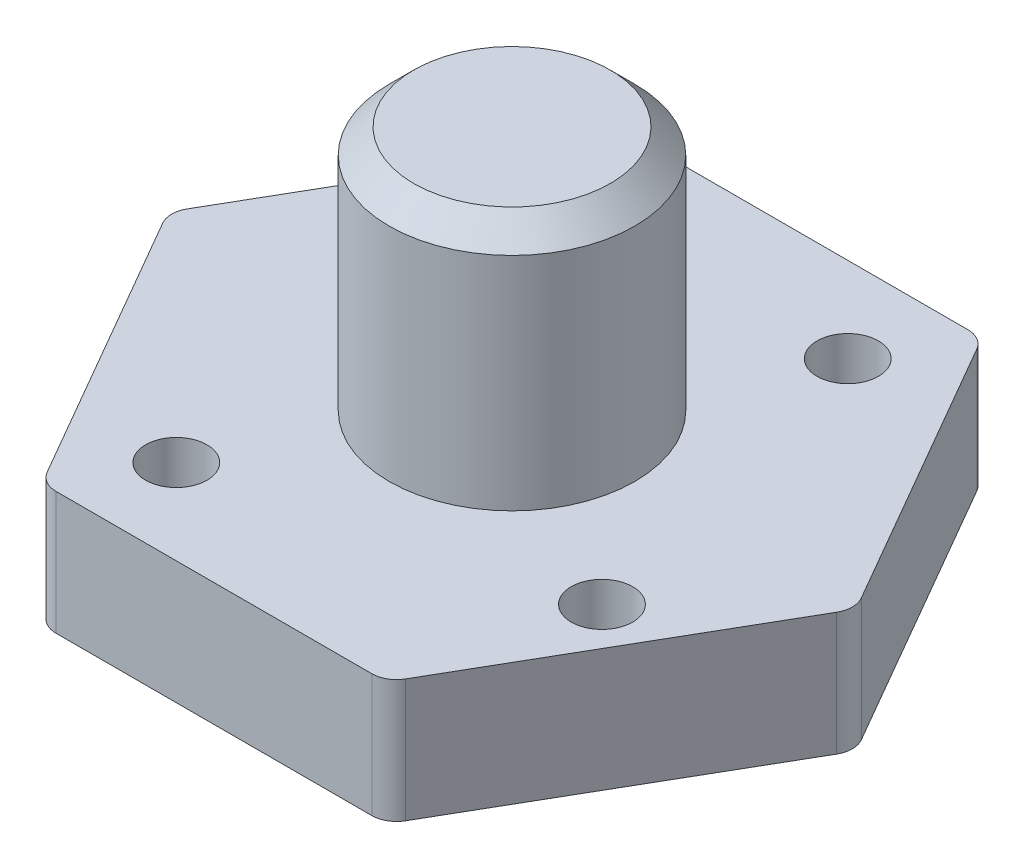
from build123d import *

# Parameters (mm, degrees)
SKETCH_1_R      = 1.25
EXTRUDE_1_DEPTH = 5
SKETCH_2_R      = 5
EXTRUDE_2_DEPTH = 10
FILLET_1_R      = 1
CHAMFER_1_SIZE  = 1


with BuildPart() as part:
    # Эскиз1 → Бобышка-Вытянуть1 (new body)
    with BuildSketch(Plane(origin=(0, 0, 0), x_dir=(1, 0, 0), z_dir=(0, 1, 0))):
        Polygon((14, 0), (7, 12.124355653), (-7, 12.124355653), (-14, 0), (-7, -12.124355653), (7, -12.124355653), align=None)
        with Locations(Location((5, 8.660254038, 0), (0, 0, 270))):
            Circle(SKETCH_1_R, mode=Mode.SUBTRACT)
        with Locations(Location((8.660254038, -5, 0), (0, 0, 270))):
            Circle(SKETCH_1_R, mode=Mode.SUBTRACT)
        with Locations(Location((-5, -8.660254038, 0), (0, 0, 270))):
            Circle(SKETCH_1_R, mode=Mode.SUBTRACT)
        with Locations(Location((-8.660254038, 5, 0), (0, 0, 270))):
            Circle(SKETCH_1_R, mode=Mode.SUBTRACT)
    extrude(amount=EXTRUDE_1_DEPTH)

    # Эскиз2 → Бобышка-Вытянуть2 (add)
    with BuildSketch(Plane(origin=(0, 5, 0), x_dir=(1, 0, 0), z_dir=(0, 1, 0))):
        with Locations(Location((0, 0, 0), (0, 0, 270))):
            Circle(SKETCH_2_R)
    extrude(amount=EXTRUDE_2_DEPTH)

    # Скругление1
    fillet_1_edges = [part.edges().sort_by_distance(p)[0] for p in [
        (7, 2.5, 12.124355653),
        (-7, 2.5, 12.124355653),
        (-14, 2.5, 0),
        (-7, 2.5, -12.124355653),
        (7, 2.5, -12.124355653),
        (14, 2.5, 0),
    ]]
    fillet(fillet_1_edges, radius=FILLET_1_R)

    # Фаска1
    chamfer_1_edges = [part.edges().sort_by_distance(p)[0] for p in [
        (0, 15, -5),
    ]]
    chamfer(chamfer_1_edges, length=CHAMFER_1_SIZE)


solid = part.part
